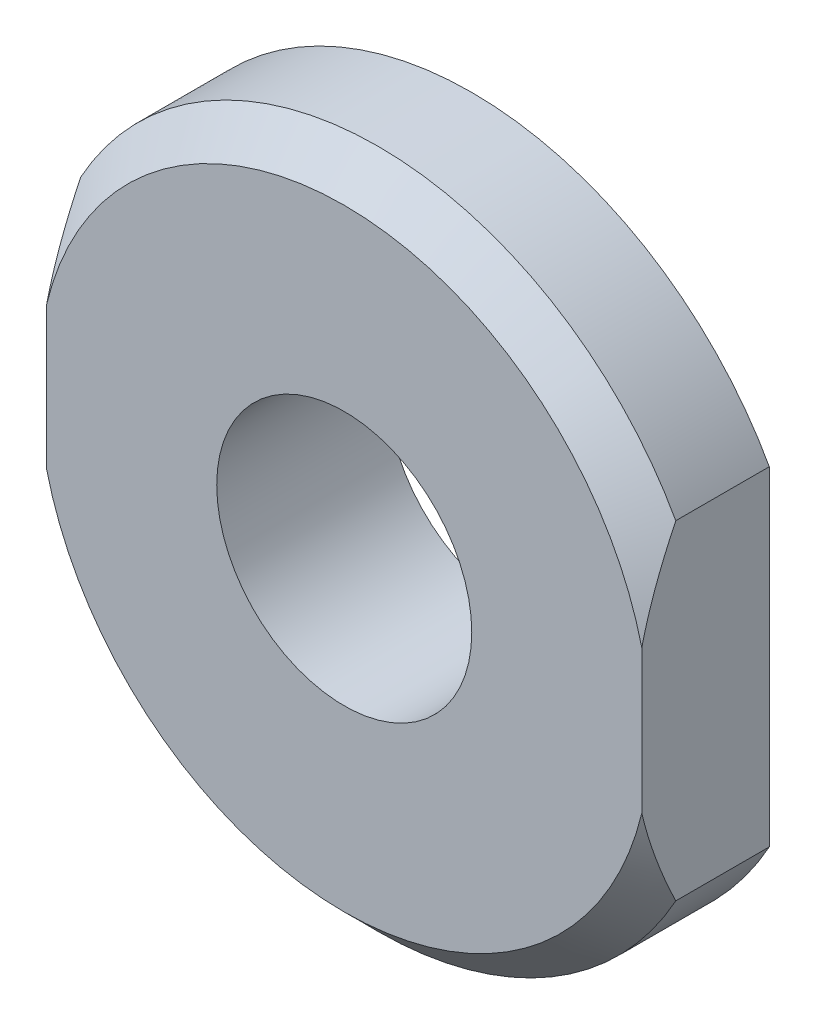
from build123d import *

# Parameters (mm, degrees)
BOSS_EXTRUDE1_DEPTH   = 1.5
SKETCH3_R             = 2.5
BOSS_EXTRUDE2_DEPTH   = 0.5
CHAMFER1_SIZE         = 0.4
F_3_0MM_DOWEL_HOLE1_D = 3


with BuildPart() as part:
    # Sketch1 → Boss-Extrude1 (new body)
    with BuildSketch(Plane.XY):
        with BuildLine():
            Line((-3.5, 1.936491673), (-3.5, -1.936491673))
            ThreePointArc((-3.5, -1.936491673), (0, -4), (3.5, -1.936491673))
            Line((3.5, -1.936491673), (3.5, 1.936491673))
            ThreePointArc((3.5, 1.936491673), (0, 4), (-3.5, 1.936491673))
        make_face()
    extrude(amount=BOSS_EXTRUDE1_DEPTH)

    # Sketch3 → Boss-Extrude2 (add)
    with BuildSketch(Plane(origin=(0, 0, 0), x_dir=(-1, 0, 0), z_dir=(0, 0, -1))):
        Circle(SKETCH3_R)
    extrude(amount=BOSS_EXTRUDE2_DEPTH)

    # Chamfer1
    chamfer1_edges = [part.edges().sort_by_distance(p)[0] for p in [
        (0, 4, 1.5),
        (0, -4, 1.5),
    ]]
    chamfer(chamfer1_edges, length=CHAMFER1_SIZE)

    # Ø3.0mm Dowel Hole1 (through all)
    with Locations(Plane.XY.offset(1.5)):
        with Locations((0, 0)):
            Hole(F_3_0MM_DOWEL_HOLE1_D / 2)


solid = part.part
